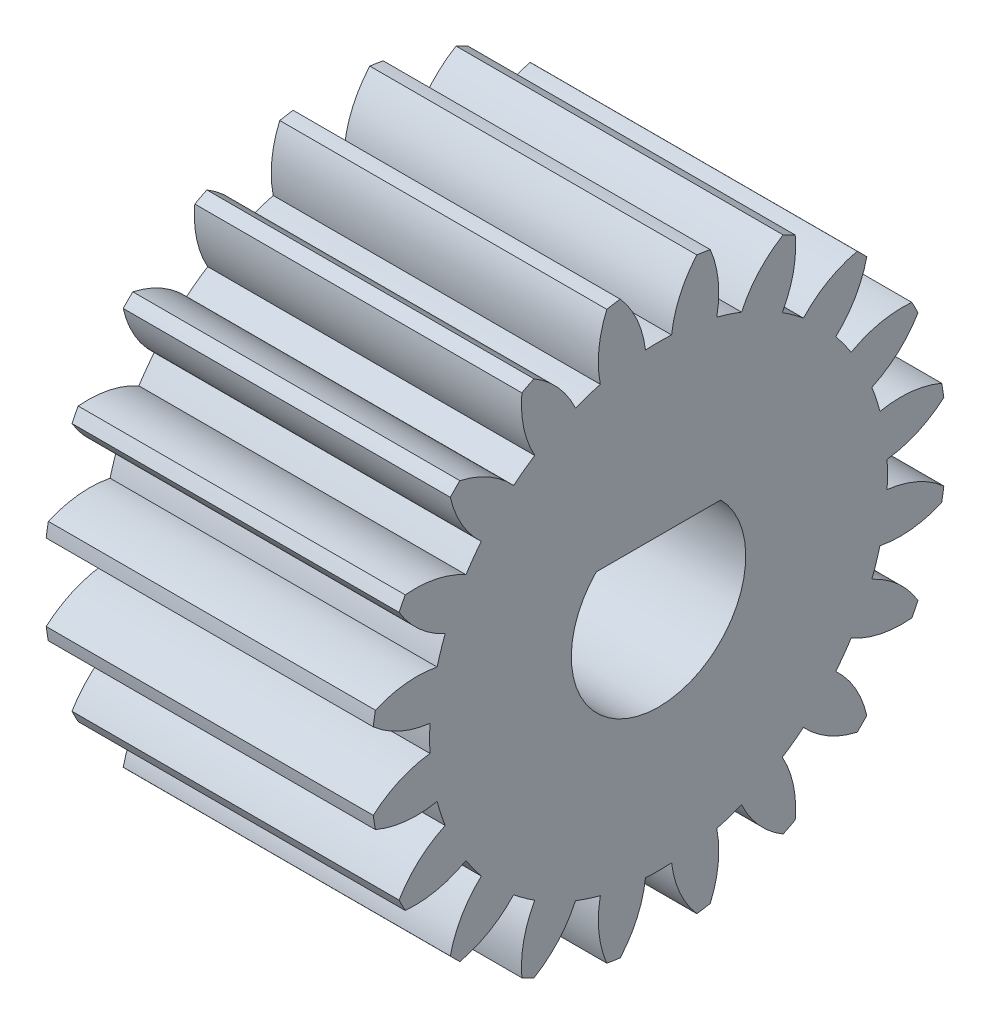
from build123d import *

# Parameters (mm, degrees)
BASPROSKE_W         = 15
BASPROSKE_H         = 13.2
TOOTHCUT_DEPTH      = 24.947442452
TEETHCUTS_COUNT     = 20
TEETHCUTS_ANGLE     = 342
BORSKE_R            = 4
BORE_DEPTH          = 50.0000508
BOSS_EXTRUDE1_START = -15
BOSS_EXTRUDE1_DEPTH = 15
SKETCH2_R           = 7.2
SKETCH2_R_2         = 6
CUT_EXTRUDE1_DEPTH  = 0.5


with BuildPart() as part:
    # BasProSke → Base-Revolve (revolve)
    with BuildSketch(Plane(origin=(0, 0, 0), x_dir=(1, 0, 0), z_dir=(0, 1, 0)), mode=Mode.PRIVATE) as base_revolve_sk:
        with Locations((7.5, 6.6)):
            Rectangle(BASPROSKE_W, BASPROSKE_H)
    revolve(base_revolve_sk.sketch.rotate(Axis((-10, 0, 0), (1, 0, 0)), 180), axis=Axis((-10, 0, 0), (1, 0, 0)))

    # TooCutSke → ToothCut (cut, through all)
    with BuildSketch(Plane(origin=(0, 0, 0), x_dir=(0, 0, -1), z_dir=(1, 0, 0))):
        with BuildLine():
            ThreePointArc((0.599012827, 10.48189795), (0, 10.499), (-0.599012827, 10.48189795))
            ThreePointArc((-0.599012827, 10.48189795), (-0.986906343, 11.883983562), (-1.777012823, 13.105473306))
            ThreePointArc((-1.777012823, 13.105473306), (0, 13.2254), (1.777012823, 13.105473306))
            ThreePointArc((1.777012823, 13.105473306), (0.986906343, 11.883983562), (0.599012827, 10.48189795))
        make_face()
    toothcut = extrude(amount=TOOTHCUT_DEPTH, mode=Mode.SUBTRACT)

    # TeethCuts: ToothCut ×20 about axis
    teethcuts_axis = Axis((-10, 0, 0), (1, 0, 0))
    for i in range(1, TEETHCUTS_COUNT):
        add(toothcut.rotate(teethcuts_axis, i * TEETHCUTS_ANGLE / (TEETHCUTS_COUNT - 1)), mode=Mode.SUBTRACT)

    # BorSke → Bore (cut, symmetric)
    with BuildSketch(Plane(origin=(0, 0, 0), x_dir=(0, 0, -1), z_dir=(1, 0, 0))):
        with Locations(Location((0, 0, 0), (0, 0, 180))):
            Circle(BORSKE_R)
    extrude(amount=BORE_DEPTH, both=True, mode=Mode.SUBTRACT)

    # Sketch1 → Boss-Extrude1 (add)
    with BuildSketch(Plane.ZY.offset(BOSS_EXTRUDE1_START)):
        with BuildLine():
            Line((-2.856571371, 2.8), (2.856571371, 2.8))
            ThreePointArc((2.856571371, 2.8), (0, 4), (-2.856571371, 2.8))
        make_face()
    extrude(amount=BOSS_EXTRUDE1_DEPTH)

    # Sketch2 → Cut-Extrude1 (cut)
    with BuildSketch(Plane.ZY):
        Circle(SKETCH2_R)
        Circle(SKETCH2_R_2, mode=Mode.SUBTRACT)
    extrude(amount=-CUT_EXTRUDE1_DEPTH, mode=Mode.SUBTRACT)


solid = part.part
